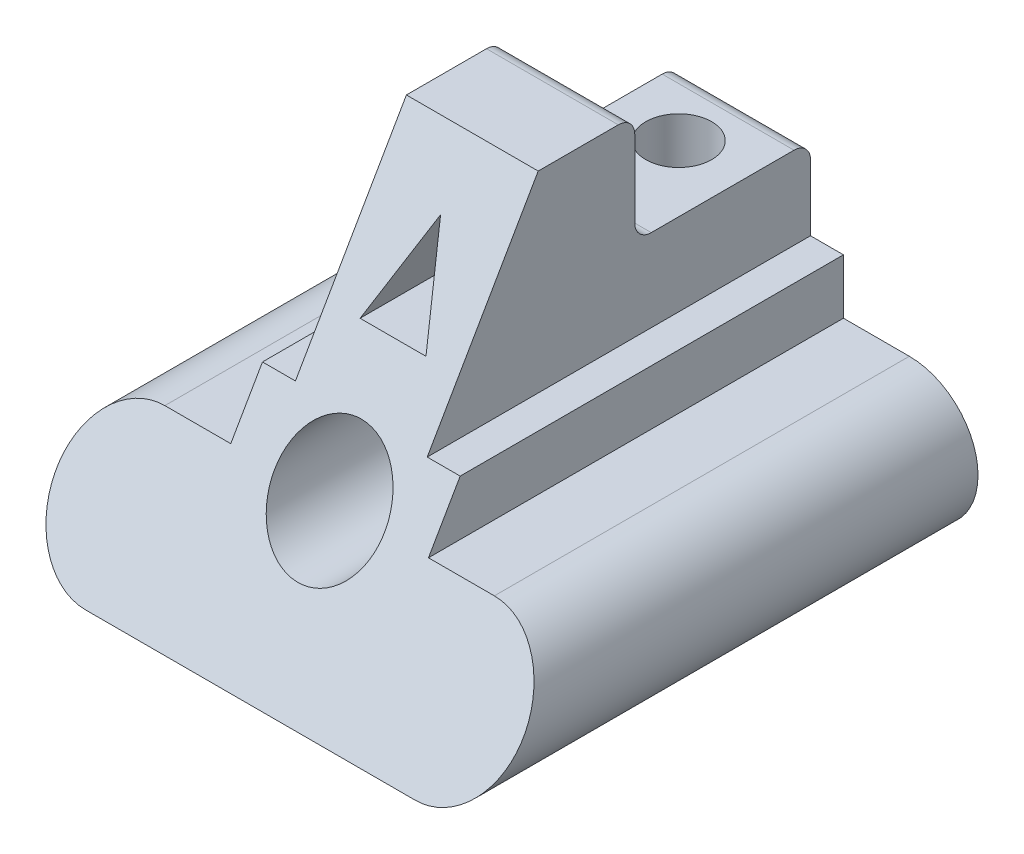
from build123d import *

# Parameters (mm, degrees)
BOSS_EXTRUDE1_DEPTH     = 45
CUT_EXTRUDE1_DEPTH      = 85.483726244
CUT_EXTRUDE1_DEPTH_BACK = 85.483726244
SKETCH3_R               = 10
CUT_EXTRUDE2_DEPTH      = 85.483726244
CUT_EXTRUDE3_DEPTH      = 92.112567739
CUT_EXTRUDE3_DEPTH_BACK = 92.112567739
SKETCH5_W               = 32
SKETCH5_H               = 20
CUT_EXTRUDE4_DEPTH      = 94.441157955
CUT_EXTRUDE4_DEPTH_BACK = 94.441157955
SKETCH4_R               = 6
FILLET1_R               = 3


with BuildPart() as part:
    # Sketch1 → Boss-Extrude1 (new, symmetric)
    with BuildSketch(Plane.XY):
        with BuildLine():
            Line((-30, -12.5), (30, -12.5))
            ThreePointArc((30, -12.5), (42.5, 0), (30, 12.5))
            Line((30, 12.5), (18, 12.5))
            Line((18, 12.5), (18, 22.5))
            Line((18, 22.5), (12, 22.5))
            Line((12, 22.5), (12, 57.5))
            Line((12, 57.5), (-12, 57.5))
            Line((-12, 57.5), (-12, 22.5))
            Line((-12, 22.5), (-18, 22.5))
            Line((-18, 22.5), (-18, 12.5))
            Line((-18, 12.5), (-30, 12.5))
            ThreePointArc((-30, 12.5), (-42.5, 0), (-30, -12.5))
        make_face()
    extrude(amount=BOSS_EXTRUDE1_DEPTH, both=True)

    # Sketch2 → Cut-Extrude1 (cut, two sides: drawn at the far end of the back side and taken through both)
    with BuildSketch(Plane(origin=(0, 0, 0), x_dir=(0, 0, -1), z_dir=(1, 0, 0)).offset(-CUT_EXTRUDE1_DEPTH_BACK)):
        Polygon((-4.585481157, 57.5), (-45, -12.5), (-45, 57.5), align=None)
    extrude(amount=CUT_EXTRUDE1_DEPTH + CUT_EXTRUDE1_DEPTH_BACK, mode=Mode.SUBTRACT)

    # Sketch3 → Cut-Extrude2 (cut, through all)
    with BuildSketch(Plane.XY):
        with Locations(Location((0, 12.5, 0), (0, 0, 90))):
            Circle(SKETCH3_R)
        Polygon((0, 47.5), (-6, 32.5), (6, 32.5), align=None)
    extrude(amount=CUT_EXTRUDE2_DEPTH, mode=Mode.SUBTRACT)

    # Sketch5 → Cut-Extrude3 (cut, two sides: drawn at the far end of the back side and taken through both)
    with BuildSketch(Plane.ZY.offset(12).offset(-CUT_EXTRUDE3_DEPTH_BACK)):
        with Locations((-29, 47.5)):
            Rectangle(SKETCH5_W, SKETCH5_H)
    extrude(amount=CUT_EXTRUDE3_DEPTH + CUT_EXTRUDE3_DEPTH_BACK, mode=Mode.SUBTRACT)

    # Sketch4 → Cut-Extrude4 (cut, two sides: drawn at the far end of the back side and taken through both)
    with BuildSketch(Plane(origin=(0, 57.5, 0), x_dir=(1, 0, 0), z_dir=(0, 1, 0)).offset(-CUT_EXTRUDE4_DEPTH_BACK)):
        with Locations(Location((0, 33, 0), (0, 0, 270))):
            Circle(SKETCH4_R)
    extrude(amount=CUT_EXTRUDE4_DEPTH + CUT_EXTRUDE4_DEPTH_BACK, mode=Mode.SUBTRACT)

    # Fillet1
    fillet1_edges = [part.edges().sort_by_distance(p)[0] for p in [
        (0, 37.5, -45),
        (0, 57.5, -13),
        (0, 37.5, -13),
    ]]
    fillet(fillet1_edges, radius=FILLET1_R)


solid = part.part
